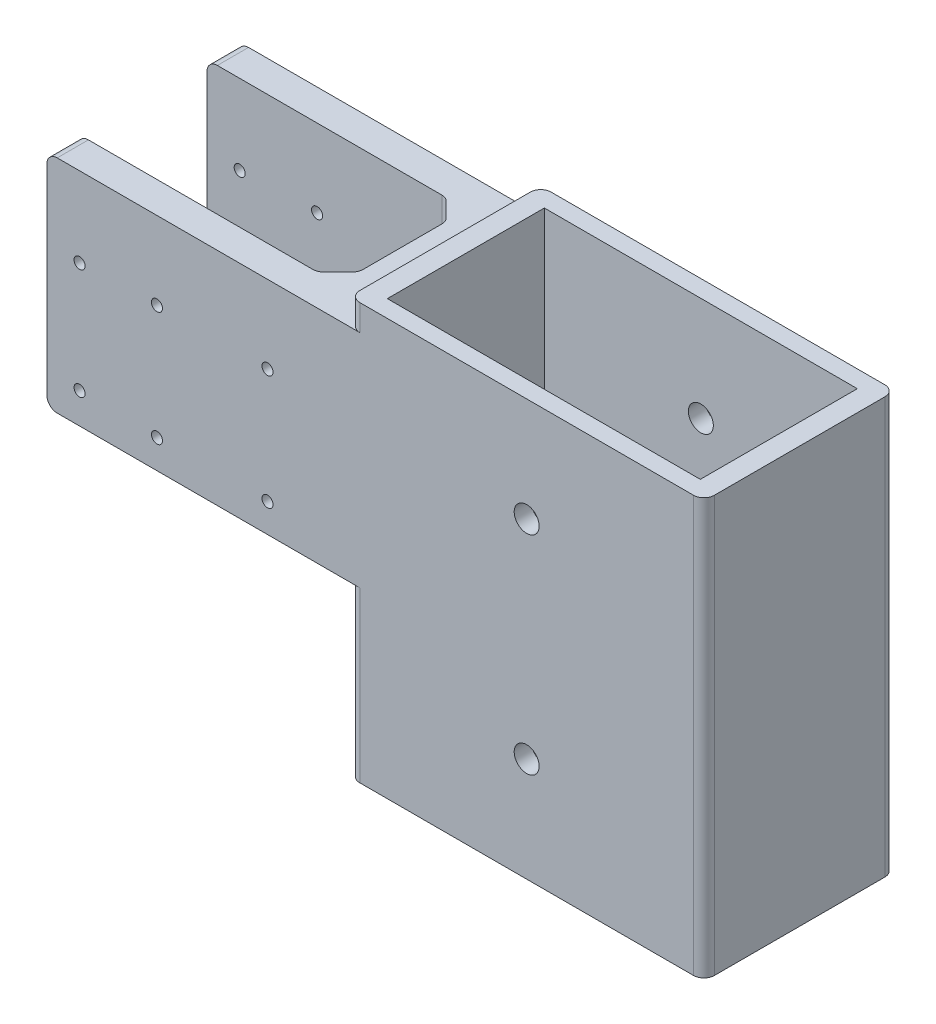
from build123d import *

# Parameters (mm, degrees)
SKETCH1_R           = 1.35
BOSS_EXTRUDE1_DEPTH = 46.736
SKETCH2_W           = 76.454
SKETCH2_H           = 38.354
CUT_EXTRUDE1_DEPTH  = 137.16
FILLET1_R           = 2.54
SKETCH3_R           = 3.05
CUT_EXTRUDE2_DEPTH  = 66.294


with BuildPart() as part:
    # Sketch1 → Boss-Extrude1 (new body)
    with BuildSketch(Plane.XY):
        Polygon((-53.90661, 47), (-53.90661, -7), (20, -7), (20, -48.25), (106.614, -48.25), (106.614, 53.35), (20, 53.35), (20, 47), align=None)
        Circle(SKETCH1_R, mode=Mode.SUBTRACT)
        with Locations((-27, 0)):
            Circle(SKETCH1_R, mode=Mode.SUBTRACT)
        with Locations((-45.90661, 0.5)):
            Circle(SKETCH1_R, mode=Mode.SUBTRACT)
        with Locations((-45.90661, 27.5)):
            Circle(SKETCH1_R, mode=Mode.SUBTRACT)
        with Locations((-27, 28)):
            Circle(SKETCH1_R, mode=Mode.SUBTRACT)
        with Locations((0, 28)):
            Circle(SKETCH1_R, mode=Mode.SUBTRACT)
    extrude(amount=BOSS_EXTRUDE1_DEPTH)

    # Sketch2 → Cut-Extrude1 (cut)
    with BuildSketch(Plane(origin=(0, 53.35, 0), x_dir=(1, 0, 0), z_dir=(0, 1, 0))):
        Polygon((-53.90661, -7.62), (4.51339, -7.62), (9.59339, -12.7), (9.59339, -34.036), (4.51339, -39.116), (-53.90661, -39.116), align=None)
        with Locations((63.307, -23.368)):
            Rectangle(SKETCH2_W, SKETCH2_H)
    extrude(amount=-CUT_EXTRUDE1_DEPTH, mode=Mode.SUBTRACT)

    # Fillet1
    fillet1_edges = [part.edges().sort_by_distance(p)[0] for p in [
        (20, 50.175, 0),
        (-53.90661, -7, 42.926),
        (-53.90661, 47, 42.926),
        (20, -27.625, 46.736),
        (106.614, 2.55, 46.736),
        (-53.90661, -7, 3.81),
        (-53.90661, 47, 3.81),
        (4.51339, 20, 7.62),
        (9.59339, 20, 12.7),
        (9.59339, 20, 34.036),
        (4.51339, 20, 39.116),
        (106.614, 2.55, 0),
        (20, 50.175, 46.736),
        (20, -27.625, 0),
    ]]
    fillet(fillet1_edges, radius=FILLET1_R)

    # Sketch3 → Cut-Extrude2 (cut)
    with BuildSketch(Plane.XY.offset(46.736)):
        with Locations((63.307, 27.95)):
            Circle(SKETCH3_R)
        with Locations((63.307, -22.85)):
            Circle(SKETCH3_R)
    extrude(amount=-CUT_EXTRUDE2_DEPTH, mode=Mode.SUBTRACT)


solid = part.part
